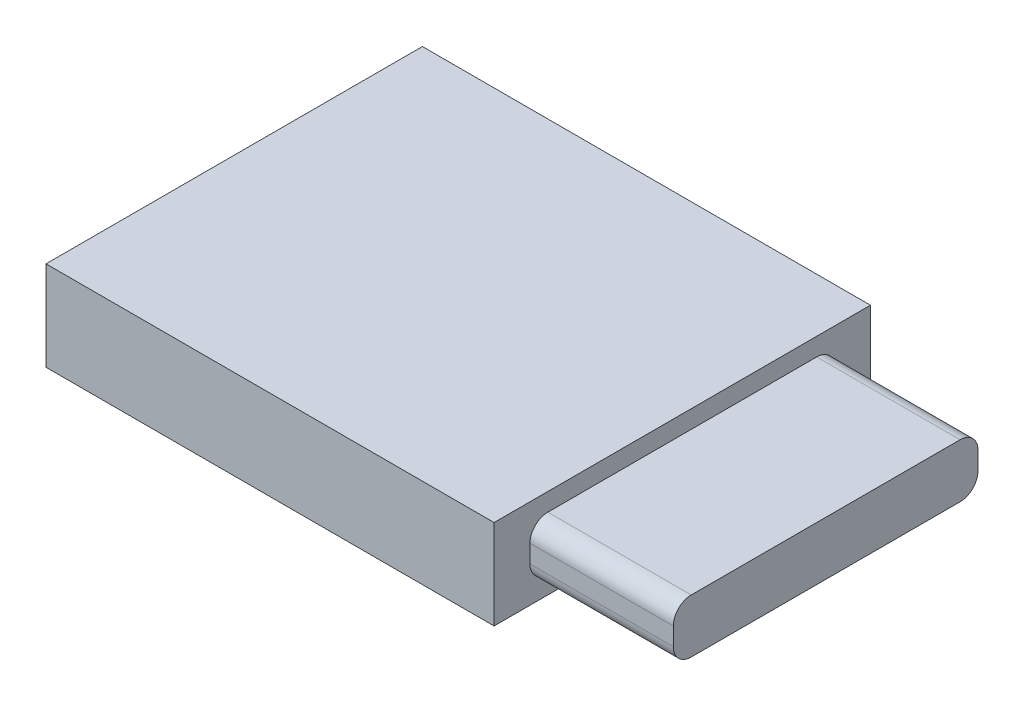
from build123d import *

# Parameters (mm, degrees)
SKETCH1_W           = 25
SKETCH1_H           = 21
BOSS_EXTRUDE1_DEPTH = 5
BOSS_EXTRUDE2_DEPTH = 8


with BuildPart() as part:
    # Sketch1 → Boss-Extrude1 (new body)
    with BuildSketch(Plane(origin=(0, 0, 0), x_dir=(1, 0, 0), z_dir=(0, 1, 0))):
        Rectangle(SKETCH1_W, SKETCH1_H)
    extrude(amount=BOSS_EXTRUDE1_DEPTH)

    # Sketch2 → Boss-Extrude2 (add)
    with BuildSketch(Plane(origin=(12.5, 0, 0), x_dir=(0, 0, -1), z_dir=(1, 0, 0))):
        with BuildLine():
            Line((-7.5, 1), (-6.3, 1))
            Line((-6.3, 1), (6.3, 4))
            Line((6.3, 4), (-7.5, 4))
            ThreePointArc((-7.5, 4), (-8.207106781, 3.707106781), (-8.5, 3))
            Line((-8.5, 3), (-8.5, 2))
            ThreePointArc((-8.5, 2), (-8.207106781, 1.292893219), (-7.5, 1))
        make_face()
        with BuildLine():
            Line((6.3, 4), (-6.3, 1))
            Line((-6.3, 1), (7.5, 1))
            ThreePointArc((7.5, 1), (8.207106781, 1.292893219), (8.5, 2))
            Line((8.5, 2), (8.5, 3))
            ThreePointArc((8.5, 3), (8.207106781, 3.707106781), (7.5, 4))
            Line((7.5, 4), (6.3, 4))
        make_face()
    extrude(amount=BOSS_EXTRUDE2_DEPTH)


solid = part.part
